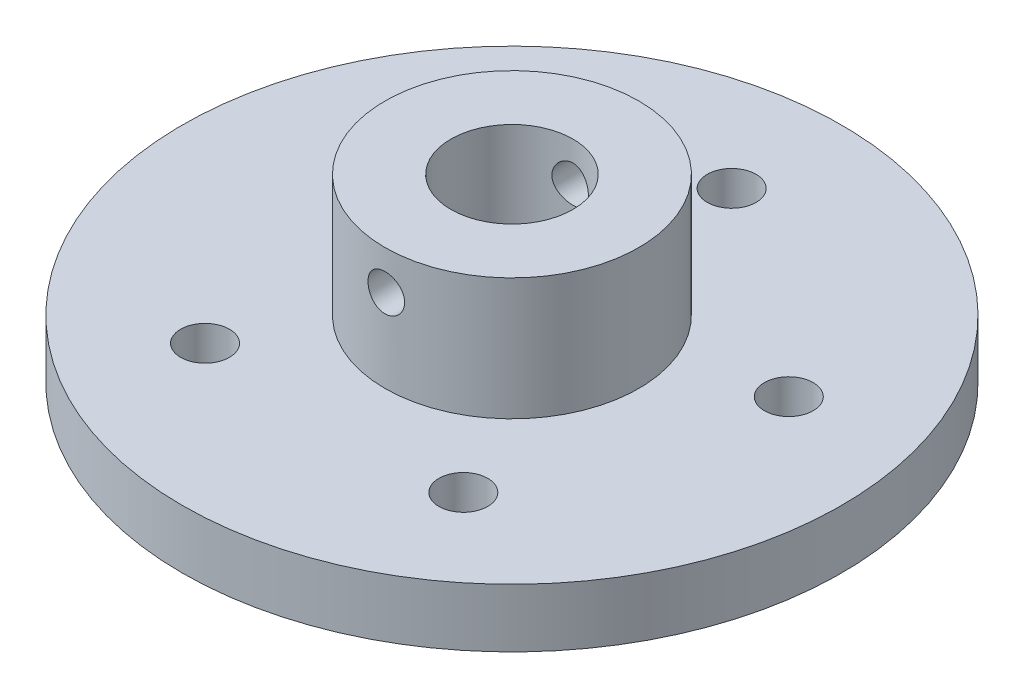
from build123d import *

# Parameters (mm, degrees)
SKETCH1_W                  = 17.145
SKETCH1_H                  = 31.75
SKETCH1_W_2                = 69.85
SKETCH1_H_2                = 15.24
F_1_2_0_5_DIAMETER_HOLE1_D = 12.7
CUT_EXTRUDE1_DEPTH         = 131.021580324
CUT_EXTRUDE1_DEPTH_BACK    = 131.021580324
SKETCH10_R                 = 4.7625


with BuildPart() as part:
    # Sketch1 → Revolve1 (revolve)
    with BuildSketch(Plane.XY, mode=Mode.PRIVATE) as revolve1_sk:
        with Locations((24.4475, 31.115)):
            Rectangle(SKETCH1_W, SKETCH1_H)
        with Locations((50.8, 7.62)):
            Rectangle(SKETCH1_W_2, SKETCH1_H_2)
    revolve(revolve1_sk.sketch.rotate(Axis((0, 7.809475806, 0), (0, -1, 0)), 90), axis=Axis((0, 7.809475806, 0), (0, -1, 0)))

    # 1/2 (0.5) Diameter Hole1 (through all)
    with Locations(Plane(origin=(0, 15.24, 0), x_dir=(1, 0, 0), z_dir=(0, 1, 0))):
        with Locations((-54.352879906, 17.660321229), (0, 57.15), (54.352879906, 17.660321229), (33.591927169, -46.235321229), (-33.591927169, -46.235321229)):
            Hole(F_1_2_0_5_DIAMETER_HOLE1_D / 2)

    # Sketch10 → Cut-Extrude1 (cut, two sides: drawn at the far end of the back side and taken through both)
    with BuildSketch(Plane.XY.offset(-CUT_EXTRUDE1_DEPTH_BACK)):
        with Locations((0, 36.83)):
            Circle(SKETCH10_R)
    extrude(amount=CUT_EXTRUDE1_DEPTH + CUT_EXTRUDE1_DEPTH_BACK, mode=Mode.SUBTRACT)


solid = part.part
